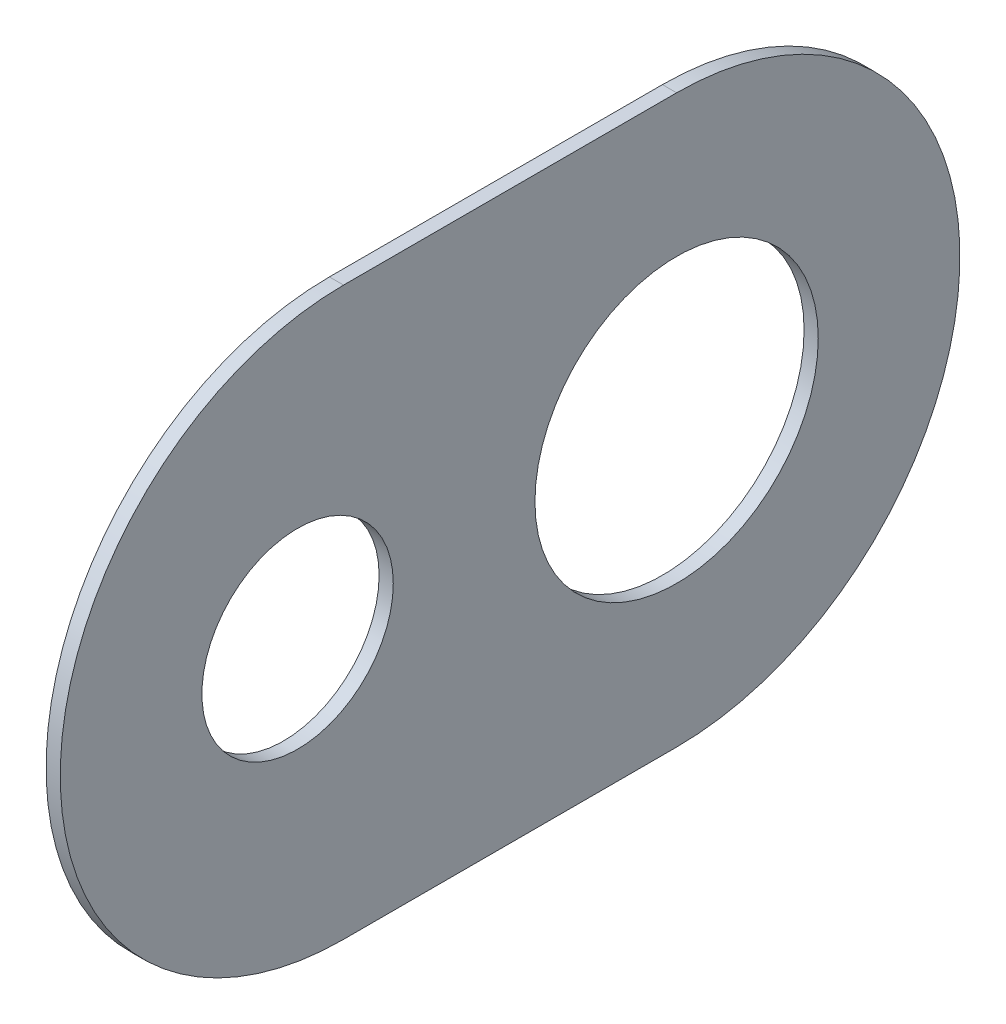
from build123d import *

# Parameters (mm, degrees)
SKETCH1_R           = 8.57885
SKETCH1_R_2         = 12.7
BOSS_EXTRUDE1_DEPTH = 1.27


with BuildPart() as part:
    # Sketch1 → Boss-Extrude1 (new body)
    with BuildSketch(Plane.YZ):
        with BuildLine():
            Line((-25.399999937, -14.928849968), (-25.399999937, 14.928849968))
            ThreePointArc((-25.399999937, 14.928849968), (0, 40.328849905), (25.399999936, 14.928849968))
            Line((25.399999936, 14.928849968), (25.399999937, -14.928849968))
            ThreePointArc((25.399999937, -14.928849968), (0, -40.328849905), (-25.399999937, -14.928849968))
        make_face()
        with Locations(Location((0, 19.049999968, 0), (0, 0, 270))):
            Circle(SKETCH1_R, mode=Mode.SUBTRACT)
        with Locations(Location((0, -14.928849968, 0), (0, 0, 270))):
            Circle(SKETCH1_R_2, mode=Mode.SUBTRACT)
    extrude(amount=BOSS_EXTRUDE1_DEPTH)


solid = part.part
